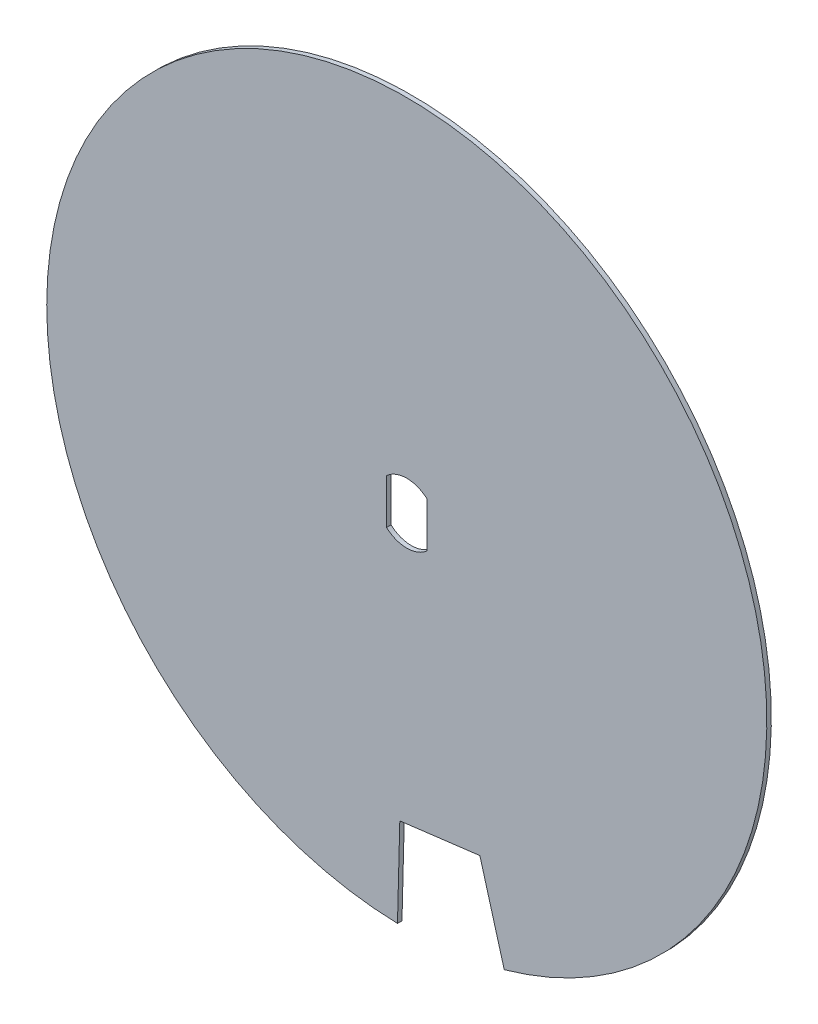
from build123d import *

# Parameters (mm, degrees)
ESQUISSE1_R             = 40
BOSS_EXTRU_1_DEPTH      = 0.5
ENL_V_MAT_EXTRU_1_DEPTH = 57.57075216
ENL_V_MAT_EXTRU_2_DEPTH = 57.57075216


with BuildPart() as part:
    # Esquisse1 → Boss.-Extru.1 (new body)
    with BuildSketch(Plane.XY):
        Circle(ESQUISSE1_R)
    extrude(amount=BOSS_EXTRU_1_DEPTH)

    # Esquisse3 → Enlèv. mat.-Extru.1 (cut, through all)
    with BuildSketch(Plane.XY.offset(0.5)):
        with BuildLine():
            Line((2.25, -2.5), (2.25, 2.5))
            ThreePointArc((2.25, 2.5), (0, 3.363406012), (-2.25, 2.5))
            Line((-2.25, 2.5), (-2.25, -2.5))
            ThreePointArc((-2.25, -2.5), (0, -3.363406012), (2.25, -2.5))
        make_face()
    extrude(amount=-ENL_V_MAT_EXTRU_1_DEPTH, mode=Mode.SUBTRACT)

    # Esquisse8 → Enlèv. mat.-Extru.2 (cut, through all)
    with BuildSketch(Plane.XY.offset(0.5)):
        with BuildLine():
            Line((8.120202921, -28.880136851), (-0.775413277, -29.986633327))
            Line((-0.775413277, -29.986633327), (-1.033999584, -39.986633327))
            ThreePointArc((-1.033999584, -39.986633327), (4.952054851, -39.69228077), (10.826937228, -38.506849134))
            Line((10.826937228, -38.506849134), (8.120202921, -28.880136851))
        make_face()
    extrude(amount=-ENL_V_MAT_EXTRU_2_DEPTH, mode=Mode.SUBTRACT)


solid = part.part
